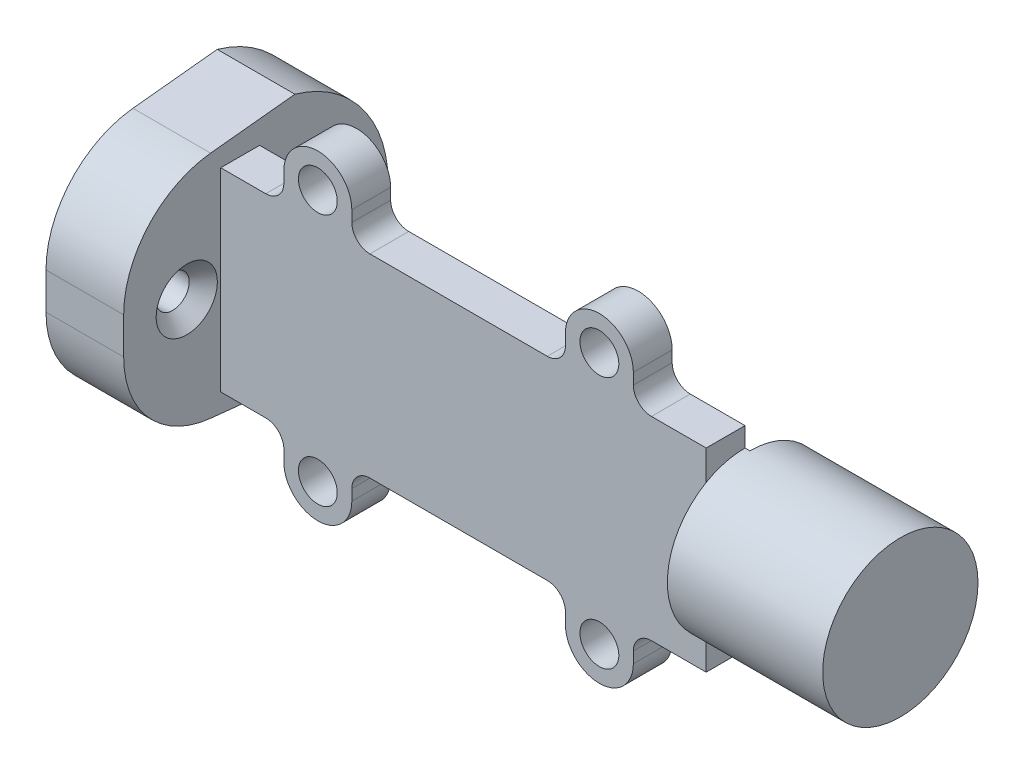
from build123d import *

# Parameters (mm, degrees)
BOSS_EXTRU_1_DEPTH                             = 4
BOSS_EXTRU_2_DEPTH                             = 8
ENL_V_START                                    = -2
ESQUISSE3_R                                    = 10.25
ENL_V_MAT_EXTRU_1_DEPTH                        = 2
ESQUISSE6_R                                    = 2
ENL_V_MAT_EXTRU_2_DEPTH                        = 40.462007045
ESQUISSE7_R                                    = 8
BOSS_EXTRU_5_DEPTH                             = 16
ENL_V_MAT_EXTRU_3_DEPTH                        = 51.786317055
ENL_V_MAT_EXTRU_3_DEPTH_BACK                   = 51.786317055
ESQUISSE9_W                                    = 0.5
ESQUISSE9_H                                    = 9.601810628
FRAISAGE_POUR_VIS_T_TE_FRAIS_E_M31_D           = 3.4
FRAISAGE_POUR_VIS_T_TE_FRAIS_E_M31_DEPTH       = 8
FRAISAGE_POUR_VIS_T_TE_FRAIS_E_M31_CSINK_D     = 6.3
FRAISAGE_POUR_VIS_T_TE_FRAIS_E_M31_CSINK_ANGLE = 90


with BuildPart() as part:
    # Esquisse1 → Boss.-Extru.1 (new body)
    with BuildSketch(Plane.XY):
        with BuildLine():
            Line((25, -10), (25, 10))
            Line((25, 10), (19.364230348, 10))
            ThreePointArc((19.364230348, 10), (18.046020427, 10.546020427), (17.5, 11.864230348))
            Line((17.5, 11.864230348), (17.5, 13))
            ThreePointArc((17.5, 13), (14, 16.5), (10.5, 13))
            Line((10.5, 13), (10.5, 11.864230348))
            ThreePointArc((10.5, 11.864230348), (9.953979573, 10.546020427), (8.635769652, 10))
            Line((8.635769652, 10), (-9.635769652, 10))
            ThreePointArc((-9.635769652, 10), (-10.953979573, 10.546020427), (-11.5, 11.864230348))
            Line((-11.5, 11.864230348), (-11.5, 13))
            ThreePointArc((-11.5, 13), (-15, 16.5), (-18.5, 13))
            Line((-18.5, 13), (-18.5, 11.864230348))
            ThreePointArc((-18.5, 11.864230348), (-19.046020427, 10.546020427), (-20.364230348, 10))
            Line((-20.364230348, 10), (-25, 10))
            Line((-25, 10), (-25, -10))
            Line((-25, -10), (-20.364230348, -10))
            ThreePointArc((-20.364230348, -10), (-19.046020427, -10.546020427), (-18.5, -11.864230348))
            Line((-18.5, -11.864230348), (-18.5, -13))
            ThreePointArc((-18.5, -13), (-15, -16.5), (-11.5, -13))
            Line((-11.5, -13), (-11.5, -11.864230348))
            ThreePointArc((-11.5, -11.864230348), (-10.953979573, -10.546020427), (-9.635769652, -10))
            Line((-9.635769652, -10), (8.635769652, -10))
            ThreePointArc((8.635769652, -10), (9.953979573, -10.546020427), (10.5, -11.864230348))
            Line((10.5, -11.864230348), (10.5, -13))
            ThreePointArc((10.5, -13), (14, -16.5), (17.5, -13))
            Line((17.5, -13), (17.5, -11.864230348))
            ThreePointArc((17.5, -11.864230348), (18.046020427, -10.546020427), (19.364230348, -10))
            Line((19.364230348, -10), (25, -10))
        make_face()
    extrude(amount=BOSS_EXTRU_1_DEPTH)

    # Esquisse2 → Boss.-Extru.2 (add)
    with BuildSketch(Plane.ZY.offset(25)):
        with BuildLine():
            Line((-3.638732785, 12.740569992), (5.045284633, 11.827842982))
            ThreePointArc((5.045284633, 11.827842982), (11.431448255, 8.573930092), (14, 1.882624029))
            Line((14, 1.882624029), (14, -1.882624029))
            ThreePointArc((14, -1.882624029), (11.431448255, -8.573930092), (5.045284633, -11.827842982))
            Line((5.045284633, -11.827842982), (-3.638732785, -12.740569992))
            ThreePointArc((-3.638732785, -12.740569992), (-13.25, 0), (-3.638732785, 12.740569992))
        make_face()
    extrude(amount=BOSS_EXTRU_2_DEPTH)

    # Esquisse3 → Enlèv. mat.-Extru.1 (cut)
    with BuildSketch(Plane.ZY.offset(33).offset(ENL_V_START)):
        Circle(ESQUISSE3_R)
    extrude(amount=ENL_V_MAT_EXTRU_1_DEPTH, mode=Mode.SUBTRACT)

    # Esquisse6 → Enlèv. mat.-Extru.2 (cut, through all)
    with BuildSketch(Plane(origin=(0, 0, 0), x_dir=(-1, 0, 0), z_dir=(0, 0, -1))):
        with Locations((15, -13)):
            Circle(ESQUISSE6_R)
        with Locations((-14, -13)):
            Circle(ESQUISSE6_R)
        with Locations((-14, 13)):
            Circle(ESQUISSE6_R)
        with Locations((15, 13)):
            Circle(ESQUISSE6_R)
    extrude(amount=-ENL_V_MAT_EXTRU_2_DEPTH, mode=Mode.SUBTRACT)

    # Esquisse7 → Boss.-Extru.5 (add)
    with BuildSketch(Plane(origin=(25, 0, 0), x_dir=(0, 0, -1), z_dir=(1, 0, 0))):
        with Locations(Location((0, 0, 0), (0, 0, 120))):
            Circle(ESQUISSE7_R)
    extrude(amount=BOSS_EXTRU_5_DEPTH)

    # Esquisse9 → Enlèv. mat.-Extru.3 (cut, two sides: drawn at the far end of the back side and taken through both)
    with BuildSketch(Plane(origin=(0, 10, 0), x_dir=(1, 0, 0), z_dir=(0, 1, 0)).offset(-ENL_V_MAT_EXTRU_3_DEPTH_BACK)):
        with Locations((25.25, 4.800905314)):
            Rectangle(ESQUISSE9_W, ESQUISSE9_H)
    extrude(amount=ENL_V_MAT_EXTRU_3_DEPTH + ENL_V_MAT_EXTRU_3_DEPTH_BACK, mode=Mode.SUBTRACT)

    # Fraisage pour vis à tête fraisée M31
    with Locations(Plane(origin=(-25, 0, 0), x_dir=(0, 0, -1), z_dir=(1, 0, 0))):
        with Locations((-7.5, 0), (7.5, 0)):
            CounterSinkHole(FRAISAGE_POUR_VIS_T_TE_FRAIS_E_M31_D / 2, FRAISAGE_POUR_VIS_T_TE_FRAIS_E_M31_CSINK_D / 2, depth=FRAISAGE_POUR_VIS_T_TE_FRAIS_E_M31_DEPTH, counter_sink_angle=FRAISAGE_POUR_VIS_T_TE_FRAIS_E_M31_CSINK_ANGLE)


solid = part.part
